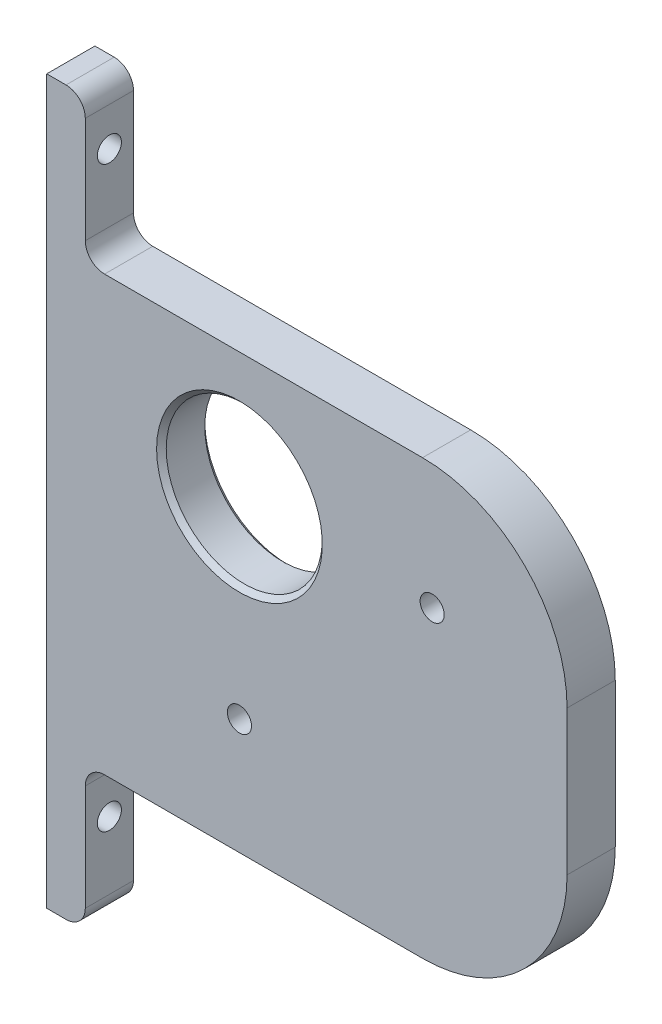
from build123d import *

# Parameters (mm, degrees)
SKETCH_1_R          = 8.1
EXTRUDE_1_DEPTH     = 5
SKETCH_2_R          = 1.25
CUT_EXTRUDE_1_DEPTH = 5
SKETCH_3_R          = 1.25
CUT_EXTRUDE_2_DEPTH = 120
CHAMFER_1_SIZE      = 0.5
SKETCH_4_W          = 16
SKETCH_4_H          = 45
CUT_EXTRUDE_3_DEPTH = 10
FILLET_1_R          = 2
FILLET_2_R          = 15


with BuildPart() as part:
    # 草图1 → 凸台-拉伸1 (new body)
    with BuildSketch(Plane.XY):
        Polygon((4, 60), (4, 75), (0, 75), (0, 0), (4, 0), (4, 15), (70, 15), (70, 60), align=None)
        with Locations((20, 47)):
            Circle(SKETCH_1_R, mode=Mode.SUBTRACT)
    extrude(amount=EXTRUDE_1_DEPTH)

    # 草图2 → 切除-拉伸1 (cut)
    with BuildSketch(Plane(origin=(4, 0, 0), x_dir=(0, 0, -1), z_dir=(1, 0, 0))):
        with Locations((-2.5, 69)):
            Circle(SKETCH_2_R)
        with Locations((-2.5, 9)):
            Circle(SKETCH_2_R)
    extrude(amount=-CUT_EXTRUDE_1_DEPTH, mode=Mode.SUBTRACT)

    # 草图3 → 切除-拉伸2 (cut)
    with BuildSketch(Plane(origin=(0, 0, 0), x_dir=(-1, 0, 0), z_dir=(0, 0, -1))):
        with Locations((-40, 47)):
            Circle(SKETCH_3_R)
        with Locations((-20, 27)):
            Circle(SKETCH_3_R)
    extrude(amount=-CUT_EXTRUDE_2_DEPTH, mode=Mode.SUBTRACT)

    # 倒角1
    chamfer_1_edges = [part.edges().sort_by_distance(p)[0] for p in [
        (11.9, 47, 0),
        (11.9, 47, 5),
    ]]
    chamfer(chamfer_1_edges, length=CHAMFER_1_SIZE)

    # 草图4 → 切除-拉伸3 (cut)
    with BuildSketch(Plane(origin=(0, 0, 0), x_dir=(-1, 0, 0), z_dir=(0, 0, -1))):
        with Locations((-62, 37.5)):
            Rectangle(SKETCH_4_W, SKETCH_4_H)
    extrude(amount=-CUT_EXTRUDE_3_DEPTH, mode=Mode.SUBTRACT)

    # 圆角1
    fillet_1_edges = [part.edges().sort_by_distance(p)[0] for p in [
        (4, 75, 2.5),
        (4, 60, 2.5),
        (4, 15, 2.5),
        (4, 0, 2.5),
    ]]
    fillet(fillet_1_edges, radius=FILLET_1_R)

    # 圆角2
    fillet_2_edges = [part.edges().sort_by_distance(p)[0] for p in [
        (54, 60, 2.5),
        (54, 15, 2.5),
    ]]
    fillet(fillet_2_edges, radius=FILLET_2_R)


solid = part.part
